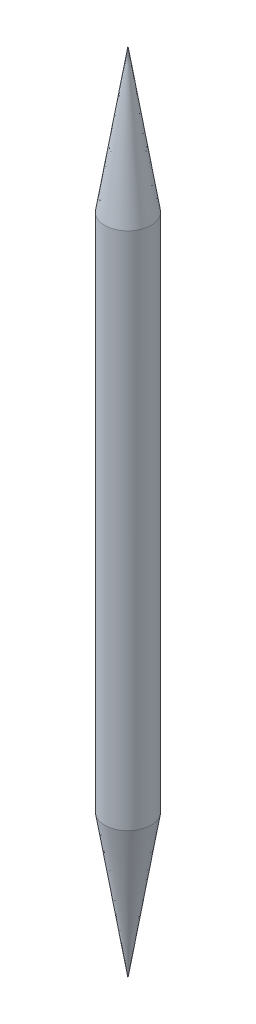
from build123d import *

# Parameters (mm, degrees)
SKETCH1_R           = 44.45
BOSS_EXTRUDE1_DEPTH = 1000


with BuildPart() as part:
    # Sketch1 → Boss-Extrude1 (new body)
    with BuildSketch(Plane(origin=(0, 0, 0), x_dir=(1, 0, 0), z_dir=(0, 1, 0))):
        with Locations(Location((0, 0, 0), (0, 0, 270))):
            Circle(SKETCH1_R)
    extrude(amount=BOSS_EXTRUDE1_DEPTH)

    # Sketch3 → Revolve3 (revolve)
    with BuildSketch(Plane.XY, mode=Mode.PRIVATE) as revolve3_sk:
        Polygon((0, 1000), (0, 1276.86), (-44.45, 1000), align=None)
    revolve(revolve3_sk.sketch.rotate(Axis((0, 1000, 0), (0, 1, 0)), 270), axis=Axis((0, 1000, 0), (0, 1, 0)))

    # Sketch4 → Revolve4 (revolve)
    with BuildSketch(Plane.XY):
        Polygon((0, 0), (0, -276.86), (-44.45, 0), align=None)
    revolve(axis=Axis((0, 0, 0), (0, -1, 0)))


solid = part.part
